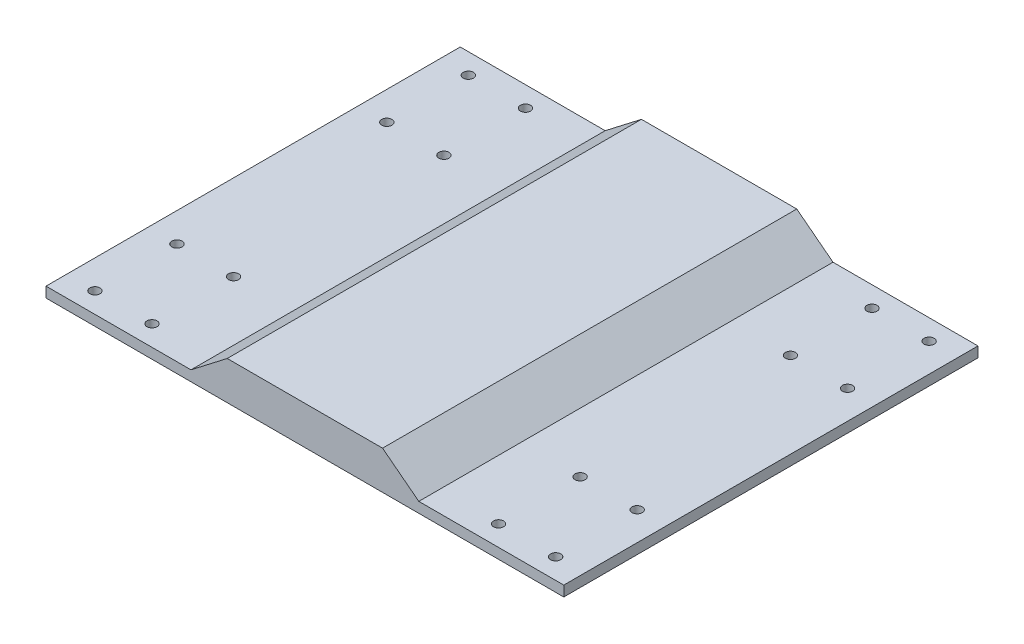
from build123d import *

# Parameters (mm, degrees)
SKETCH1_W                   = 127
SKETCH1_H                   = 101.6
BOSS_EXTRUDE1_DEPTH         = 2.54
TAP_DRILL_FOR_M3X0_5_TAP1_D = 2.5


with BuildPart() as part:
    # Sketch1 → Boss-Extrude1 (new body)
    with BuildSketch(Plane(origin=(0, 0, 0), x_dir=(1, 0, 0), z_dir=(0, 1, 0))):
        with Locations((63.5, -50.8)):
            Rectangle(SKETCH1_W, SKETCH1_H)
    extrude(amount=BOSS_EXTRUDE1_DEPTH)

    # Tap Drill for M3x0.5 Tap1 (through all)
    with Locations(Plane(origin=(0, 0, 0), x_dir=(-1, 0, 0), z_dir=(0, -1, 0))):
        with Locations((-106, -76.6), (-120, -5), (-120, -25), (-106, -5), (-106, -25), (-120, -76.6), (-131.288, -76.6), (-120, -96.6), (-106, -96.6), (-21, -96.6), (-21, -76.6), (-7.112, -76.6), (-7, -96.6), (-21, -25), (-21, -5), (-7, -5), (-7, -25)):
            Hole(TAP_DRILL_FOR_M3X0_5_TAP1_D / 2)

    # Sketch7 → Loft1 section 0
    with BuildSketch(Plane(origin=(0, 9.398, 0), x_dir=(1, 0, 0), z_dir=(0, 1, 0))):
        with BuildLine():
            Line((82.55, 0), (44.45, 0))
            Line((44.45, 0), (44.45, -101.6))
            Line((44.45, -101.6), (82.55, -101.6))
            Line((82.55, -101.6), (82.55, 0))
        make_face()
    # Sketch6 → Loft1 section 1
    with BuildSketch(Plane(origin=(0, 2.54, 0), x_dir=(1, 0, 0), z_dir=(0, 1, 0))):
        with BuildLine():
            Line((35.56, 0), (91.44, 0))
            Line((91.44, 0), (91.44, -101.6))
            Line((91.44, -101.6), (35.56, -101.6))
            Line((35.56, -101.6), (35.56, 0))
        make_face()
    loft()


solid = part.part
